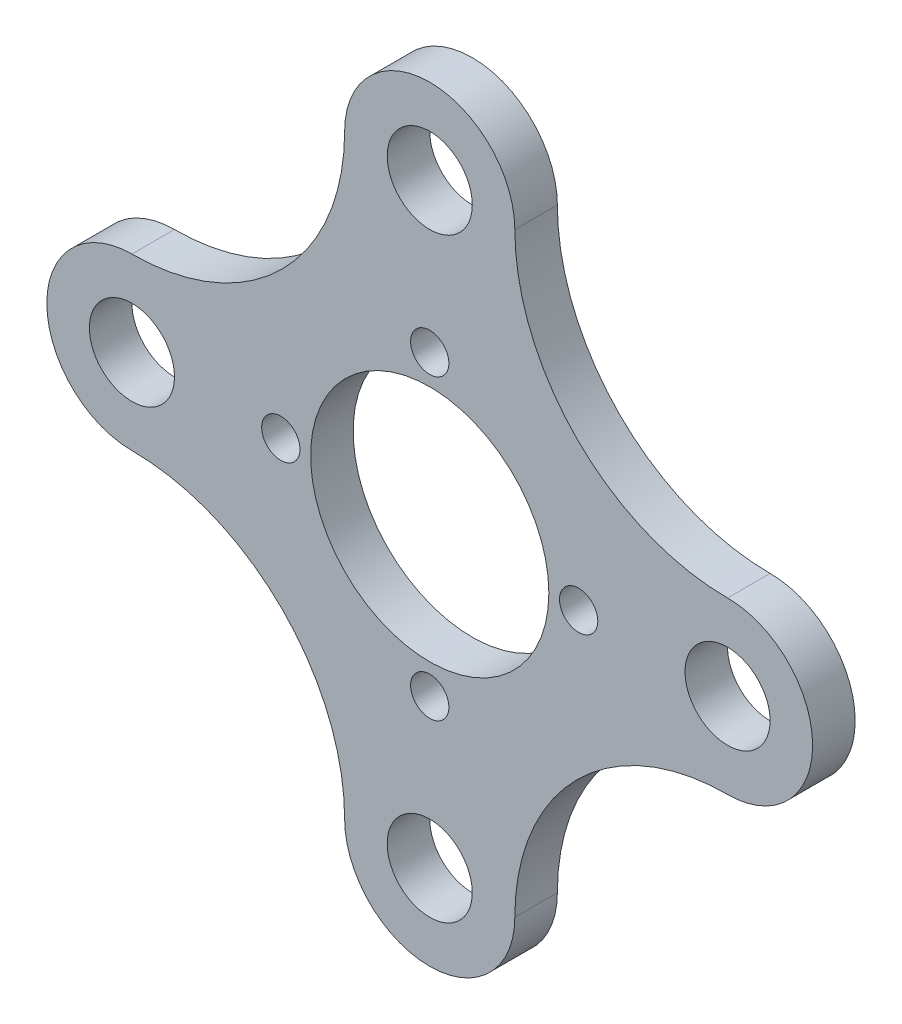
from build123d import *

# Parameters (mm, degrees)
SZKIC1_R                    = 24
SZKIC1_R_2                  = 2.25
SZKIC1_R_3                  = 14
DODANIE_WYCI_GNI_CIE1_DEPTH = 5
SZKIC2_R                    = 5
SZKIC2_R_2                  = 22.5
DODANIE_WYCI_GNI_CIE2_DEPTH = 5


with BuildPart() as part:
    # Szkic1 → Dodanie-wyciągnięcie1 (new body)
    with BuildSketch(Plane.XY):
        Circle(SZKIC1_R)
        with Locations((0, 17.5)):
            Circle(SZKIC1_R_2, mode=Mode.SUBTRACT)
        with Locations((17.5, 0)):
            Circle(SZKIC1_R_2, mode=Mode.SUBTRACT)
        with Locations((0, -17.5)):
            Circle(SZKIC1_R_2, mode=Mode.SUBTRACT)
        with Locations((-17.5, 0)):
            Circle(SZKIC1_R_2, mode=Mode.SUBTRACT)
        Circle(SZKIC1_R_3, mode=Mode.SUBTRACT)
    extrude(amount=DODANIE_WYCI_GNI_CIE1_DEPTH)

    # Szkic2 → Dodanie-wyciągnięcie2 (add)
    with BuildSketch(Plane.XY.offset(5)):
        with BuildLine():
            ThreePointArc((10, 35), (0, 45), (-10, 35))
            ThreePointArc((-10, 35), (-17.32233047, 17.32233047), (-35, 10))
            ThreePointArc((-35, 10), (-45, 0), (-35, -10))
            ThreePointArc((-35, -10), (-17.32233047, -17.32233047), (-10, -35))
            ThreePointArc((-10, -35), (0, -45), (10, -35))
            ThreePointArc((10, -35), (17.32233047, -17.32233047), (35, -10))
            ThreePointArc((35, -10), (45, 0), (35, 10))
            ThreePointArc((35, 10), (17.32233047, 17.32233047), (10, 35))
        make_face()
        with Locations((0, -35)):
            Circle(SZKIC2_R, mode=Mode.SUBTRACT)
        with Locations((-35, 0)):
            Circle(SZKIC2_R, mode=Mode.SUBTRACT)
        Circle(SZKIC2_R_2, mode=Mode.SUBTRACT)
        with Locations((35, 0)):
            Circle(SZKIC2_R, mode=Mode.SUBTRACT)
        with Locations((0, 35)):
            Circle(SZKIC2_R, mode=Mode.SUBTRACT)
    extrude(amount=-DODANIE_WYCI_GNI_CIE2_DEPTH)


solid = part.part
